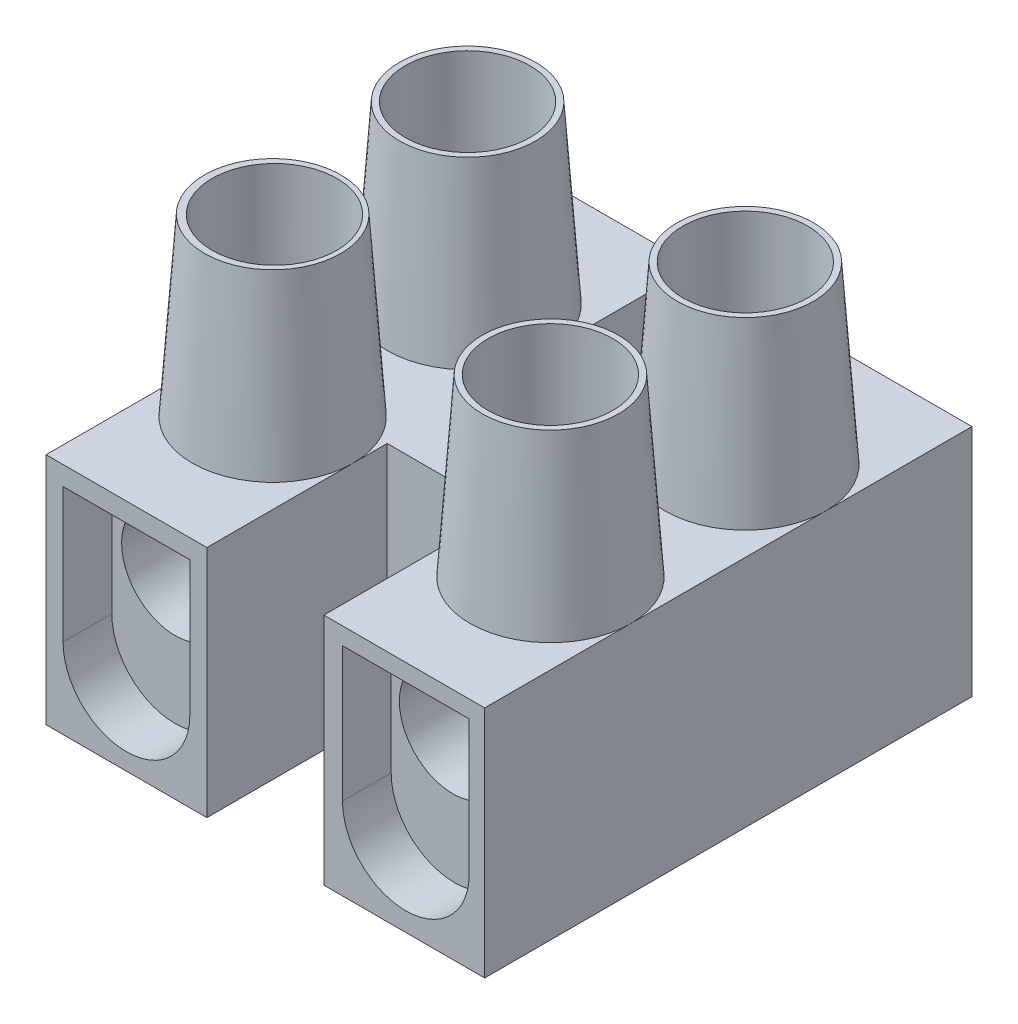
from build123d import *

# Parameters (mm, degrees)
SKETCH1_W                     = 90
SKETCH1_H                     = 48
BOSS_EXTRUDE1_DEPTH           = 50
SKETCH2_W                     = 24
SKETCH2_H                     = 37
CUT_EXTRUDE1_DEPTH            = 100
SKETCH3_W                     = 24
SKETCH3_H                     = 37
CUT_EXTRUDE2_DEPTH            = 100
SKETCH4_R                     = 8.575546541
CUT_EXTRUDE3_DEPTH            = 100
SKETCH5_R                     = 16.5
BOSS_EXTRUDE2_DEPTH           = 36
BOSS_EXTRUDE2_DRAFT           = 4
BOSS_EXTRUDE2_PROFILE_2_DEPTH = 36
BOSS_EXTRUDE2_PROFILE_2_DRAFT = 4
BOSS_EXTRUDE2_PROFILE_3_DEPTH = 36
BOSS_EXTRUDE2_PROFILE_3_DRAFT = 4
BOSS_EXTRUDE2_PROFILE_4_DEPTH = 36
BOSS_EXTRUDE2_PROFILE_4_DRAFT = 4
SKETCH6_R                     = 12.8
CUT_EXTRUDE4_DEPTH            = 30
SKETCH10_R                    = 12.8
CUT_EXTRUDE5_DEPTH            = 30
SKETCH12_W                    = 3.43330904
SKETCH12_H                    = 26.297422042
SKETCH12_W_2                  = 3.43
SKETCH12_H_2                  = 25.369176178
SKETCH12_H_3                  = 27.907235724
CUT_EXTRUDE6_DEPTH            = 3
CUT_EXTRUDE9_DEPTH            = 91.138781887
CUT_EXTRUDE9_DEPTH_BACK       = 91.138781887
BOSS_EXTRUDE3_DEPTH           = 40
BOSS_EXTRUDE3_DEPTH_BACK      = 40
SKETCH18_W                    = 26.877606789
SKETCH18_H                    = 42.955079342
BOSS_EXTRUDE3_2_DEPTH         = 40
BOSS_EXTRUDE3_2_DEPTH_BACK    = 40
SKETCH18_W_2                  = 27.278383828
SKETCH18_H_2                  = 41.502870551
CUT_EXTRUDE10_DEPTH           = 118.153745139
CUT_EXTRUDE10_DEPTH_BACK      = 118.153745139
SKETCH19_R                    = 11


with BuildPart() as part:
    # Sketch1 → Boss-Extrude1 (new, symmetric)
    with BuildSketch(Plane.XY):
        Rectangle(SKETCH1_W, SKETCH1_H)
    extrude(amount=BOSS_EXTRUDE1_DEPTH, both=True)

    # Sketch2 → Cut-Extrude1 (cut)
    with BuildSketch(Plane(origin=(0, 24, 0), x_dir=(1, 0, 0), z_dir=(0, 1, 0))):
        with Locations((0, 31.5)):
            Rectangle(SKETCH2_W, SKETCH2_H)
    extrude(amount=-CUT_EXTRUDE1_DEPTH, mode=Mode.SUBTRACT)

    # Sketch3 → Cut-Extrude2 (cut)
    with BuildSketch(Plane(origin=(0, 24, 0), x_dir=(1, 0, 0), z_dir=(0, 1, 0))):
        with Locations((0, -31.5)):
            Rectangle(SKETCH3_W, SKETCH3_H)
    extrude(amount=-CUT_EXTRUDE2_DEPTH, mode=Mode.SUBTRACT)

    # Sketch4 → Cut-Extrude3 (cut)
    with BuildSketch(Plane(origin=(0, 24, 0), x_dir=(1, 0, 0), z_dir=(0, 1, 0))):
        with Locations(Location((0, 0, 0), (0, 0, 270))):
            Circle(SKETCH4_R)
    extrude(amount=-CUT_EXTRUDE3_DEPTH, mode=Mode.SUBTRACT)


with BuildPart() as boss_extrude2_tool:
    # Sketch5 → Boss-Extrude2 (with draft: the straight prism first)
    with BuildSketch(Plane(origin=(0, 24, 0), x_dir=(1, 0, 0), z_dir=(0, 1, 0))):
        with Locations((28.5, 20)):
            Circle(SKETCH5_R)
    extrude(amount=BOSS_EXTRUDE2_DEPTH)
    # Boss-Extrude2: the draft: its side faces are tilted about the plane it starts from
    boss_extrude2_sides = [boss_extrude2_tool.faces().sort_by_distance(p)[0] for p in [
        (12, 42, -20),
    ]]
    draft(boss_extrude2_sides, Plane(origin=(0, 24, 0), x_dir=(1, 0, 0), z_dir=(0, 1, 0)), BOSS_EXTRUDE2_DRAFT)


with BuildPart() as part_1:
    add(part.part)

    # Boss-Extrude2: add boss_extrude2_tool
    add(boss_extrude2_tool.part)


with BuildPart() as boss_extrude2_profile_2_tool:
    # Sketch5 → Boss-Extrude2 profile 2 (with draft: the straight prism first)
    with BuildSketch(Plane(origin=(0, 24, 0), x_dir=(1, 0, 0), z_dir=(0, 1, 0))):
        with Locations((-28.5, 20)):
            Circle(SKETCH5_R)
    extrude(amount=BOSS_EXTRUDE2_PROFILE_2_DEPTH)
    # Boss-Extrude2 profile 2: the draft: its side faces are tilted about the plane it starts from
    boss_extrude2_profile_2_sides = [boss_extrude2_profile_2_tool.faces().sort_by_distance(p)[0] for p in [
        (-45, 42, -20),
    ]]
    draft(boss_extrude2_profile_2_sides, Plane(origin=(0, 24, 0), x_dir=(1, 0, 0), z_dir=(0, 1, 0)), BOSS_EXTRUDE2_PROFILE_2_DRAFT)


with BuildPart() as part_2:
    add(part_1.part)

    # Boss-Extrude2 profile 2: add boss_extrude2_profile_2_tool
    add(boss_extrude2_profile_2_tool.part)


with BuildPart() as boss_extrude2_profile_3_tool:
    # Sketch5 → Boss-Extrude2 profile 3 (with draft: the straight prism first)
    with BuildSketch(Plane(origin=(0, 24, 0), x_dir=(1, 0, 0), z_dir=(0, 1, 0))):
        with Locations((-28.5, -20)):
            Circle(SKETCH5_R)
    extrude(amount=BOSS_EXTRUDE2_PROFILE_3_DEPTH)
    # Boss-Extrude2 profile 3: the draft: its side faces are tilted about the plane it starts from
    boss_extrude2_profile_3_sides = [boss_extrude2_profile_3_tool.faces().sort_by_distance(p)[0] for p in [
        (-45, 42, 20),
    ]]
    draft(boss_extrude2_profile_3_sides, Plane(origin=(0, 24, 0), x_dir=(1, 0, 0), z_dir=(0, 1, 0)), BOSS_EXTRUDE2_PROFILE_3_DRAFT)


with BuildPart() as part_3:
    add(part_2.part)

    # Boss-Extrude2 profile 3: add boss_extrude2_profile_3_tool
    add(boss_extrude2_profile_3_tool.part)


with BuildPart() as boss_extrude2_profile_4_tool:
    # Sketch5 → Boss-Extrude2 profile 4 (with draft: the straight prism first)
    with BuildSketch(Plane(origin=(0, 24, 0), x_dir=(1, 0, 0), z_dir=(0, 1, 0))):
        with Locations((28.5, -20)):
            Circle(SKETCH5_R)
    extrude(amount=BOSS_EXTRUDE2_PROFILE_4_DEPTH)
    # Boss-Extrude2 profile 4: the draft: its side faces are tilted about the plane it starts from
    boss_extrude2_profile_4_sides = [boss_extrude2_profile_4_tool.faces().sort_by_distance(p)[0] for p in [
        (12, 42, 20),
    ]]
    draft(boss_extrude2_profile_4_sides, Plane(origin=(0, 24, 0), x_dir=(1, 0, 0), z_dir=(0, 1, 0)), BOSS_EXTRUDE2_PROFILE_4_DRAFT)


with BuildPart() as part_4:
    add(part_3.part)

    # Boss-Extrude2 profile 4: add boss_extrude2_profile_4_tool
    add(boss_extrude2_profile_4_tool.part)

    # Sketch6 → Cut-Extrude4 (cut)
    with BuildSketch(Plane(origin=(0, 60, 0), x_dir=(1, 0, 0), z_dir=(0, 1, 0))):
        with Locations(Location((-28.5, 20, 0), (0, 0, 270))):
            Circle(SKETCH6_R)
    extrude(amount=-CUT_EXTRUDE4_DEPTH, mode=Mode.SUBTRACT)

    # Sketch10 → Cut-Extrude5 (cut)
    with BuildSketch(Plane(origin=(0, 60, 0), x_dir=(1, 0, 0), z_dir=(0, 1, 0))):
        with Locations(Location((-28.275205781, -19.851723188, 0), (0, 0, 270))):
            Circle(SKETCH10_R)
        with Locations(Location((28.5, -20, 0), (0, 0, 270))):
            Circle(SKETCH10_R)
        with Locations(Location((28.5, 20, 0), (0, 0, 270))):
            Circle(SKETCH10_R)
    extrude(amount=-CUT_EXTRUDE5_DEPTH, mode=Mode.SUBTRACT)

    # Sketch12 → Cut-Extrude6 (cut)
    with BuildSketch(Plane(origin=(0, 30, 0), x_dir=(1, 0, 0), z_dir=(0, 1, 0))):
        with Locations((28.5, 20)):
            Rectangle(SKETCH12_W, SKETCH12_H)
        with Locations((-28.5, 20)):
            Rectangle(SKETCH12_W_2, SKETCH12_H_2)
        with Locations((-28.781238017, -21.145164169)):
            Rectangle(SKETCH12_W_2, SKETCH12_H_3)
        with Locations((28.5, -21.145164169)):
            Rectangle(SKETCH12_W, SKETCH12_H_3)
    extrude(amount=-CUT_EXTRUDE6_DEPTH, mode=Mode.SUBTRACT)

    # Sketch13 → Cut-Extrude9 (cut, two sides: drawn at the far end of the back side and taken through both)
    with BuildSketch(Plane.XY.offset(-CUT_EXTRUDE9_DEPTH_BACK)):
        with BuildLine():
            Line((-41.509252601, 20.090355514), (-41.509252601, -7.531799792))
            ThreePointArc((-41.509252601, -7.531799792), (-28.504209783, -20.53684261), (-15.499166965, -7.531799792))
            Line((-15.499166965, -7.531799792), (-15.499166965, 20.090355514))
            Line((-15.499166965, 20.090355514), (-41.509252601, 20.090355514))
        make_face()
        with BuildLine():
            Line((15.82738357, 20.474162183), (15.82738357, -7.14376597))
            ThreePointArc((15.82738357, -7.14376597), (28.82738357, -20.14376597), (41.82738357, -7.14376597))
            Line((41.82738357, -7.14376597), (41.82738357, 20.474162183))
            Line((41.82738357, 20.474162183), (15.82738357, 20.474162183))
        make_face()
    extrude(amount=CUT_EXTRUDE9_DEPTH + CUT_EXTRUDE9_DEPTH_BACK, mode=Mode.SUBTRACT)


with BuildPart() as body_2:
    # Sketch18 → Boss-Extrude3 (new, two sides: drawn at the far end of the back side and taken through both)
    with BuildSketch(Plane.XY.offset(-BOSS_EXTRUDE3_DEPTH_BACK)):
        with Locations((28.77990316, 0.695239465)):
            Rectangle(SKETCH18_W, SKETCH18_H)
    extrude(amount=BOSS_EXTRUDE3_DEPTH + BOSS_EXTRUDE3_DEPTH_BACK)


with BuildPart() as body_3:
    # Sketch18 → Boss-Extrude3 2 (new, two sides: drawn at the far end of the back side and taken through both)
    with BuildSketch(Plane.XY.offset(-BOSS_EXTRUDE3_2_DEPTH_BACK)):
        with Locations((-28.612105285, -0.174130514)):
            Rectangle(SKETCH18_W_2, SKETCH18_H_2)
    extrude(amount=BOSS_EXTRUDE3_2_DEPTH + BOSS_EXTRUDE3_2_DEPTH_BACK)


with BuildPart() as cut_extrude10_tool:
    # Sketch19 → Cut-Extrude10 (new, two sides: drawn at the far end of the back side and taken through both)
    with BuildSketch(Plane(origin=(0, 0, -40), x_dir=(-1, 0, 0), z_dir=(0, 0, -1)).offset(-CUT_EXTRUDE10_DEPTH_BACK)):
        with Locations((-28.5, 6.474162183)):
            Circle(SKETCH19_R)
        with Locations((28.5, 6.090355514)):
            Circle(SKETCH19_R)
    extrude(amount=CUT_EXTRUDE10_DEPTH + CUT_EXTRUDE10_DEPTH_BACK)


with BuildPart() as body_2_1:
    add(body_2.part)

    # Cut-Extrude10: cut by cut_extrude10_tool
    add(cut_extrude10_tool.part, mode=Mode.SUBTRACT)


with BuildPart() as body_3_1:
    add(body_3.part)

    # Cut-Extrude10: cut by cut_extrude10_tool
    add(cut_extrude10_tool.part, mode=Mode.SUBTRACT)


solid = Compound([part_4.part, body_2_1.part, body_3_1.part])
